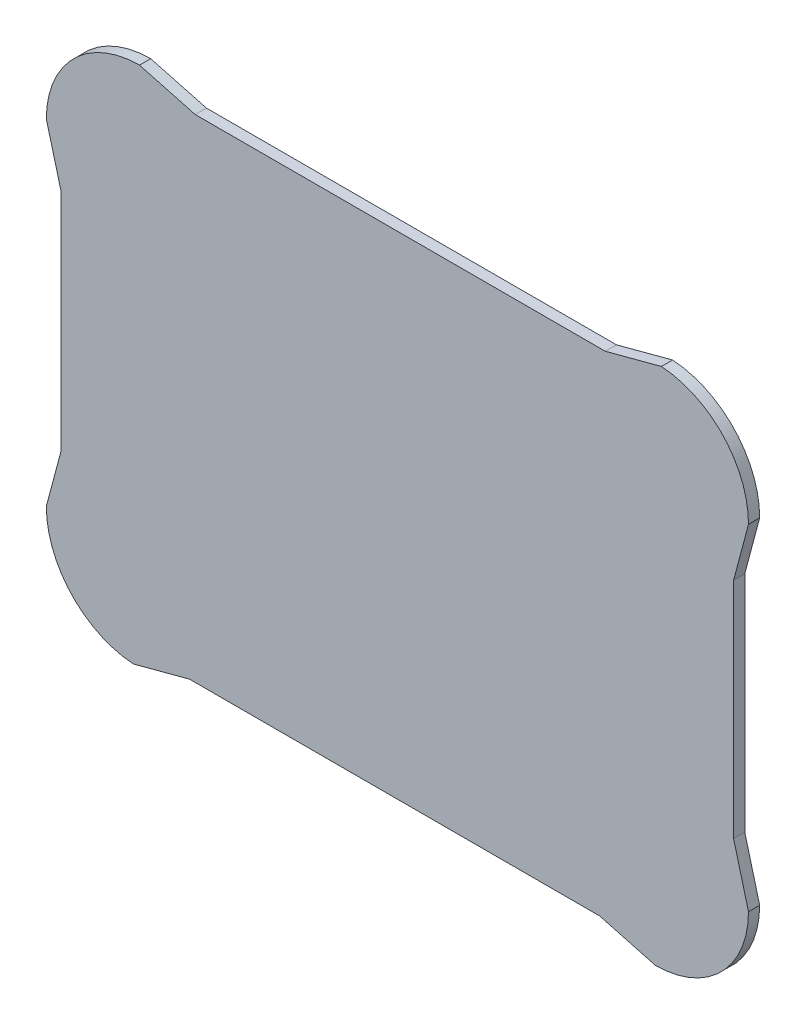
from build123d import *

# Parameters (mm, degrees)
BOSS_EXTRU_1_DEPTH = 6


with BuildPart() as part:
    # Esquisse1 → Boss.-Extru.1 (new body)
    with BuildSketch(Plane.XY):
        with BuildLine():
            Line((-373.69467463, 106.042558597), (-365.69467463, 76.042558597))
            Line((-365.69467463, 76.042558597), (-365.69467463, -43.957441403))
            Line((-365.69467463, -43.957441403), (-373.69467463, -73.957441403))
            ThreePointArc((-373.69467463, -73.957441403), (-360.192601556, -108.141248671), (-326.969404712, -123.859322601))
            Line((-326.969404712, -123.859322601), (-296.875879039, -115.85986931))
            Line((-296.875879039, -115.85986931), (-76.875879039, -115.85986931))
            Line((-76.875879039, -115.85986931), (-46.969404712, -123.859322601))
            ThreePointArc((-46.969404712, -123.859322601), (-11.649350298, -109.24901926), (3.029605382, -73.957441403))
            Line((3.029605382, -73.957441403), (-4.970394618, -43.957441403))
            Line((-4.970394618, -43.957441403), (-4.970394618, 76.042558597))
            Line((-4.970394618, 76.042558597), (3.029605382, 106.042558597))
            ThreePointArc((3.029605382, 106.042558597), (-10.442134726, 140.284021287), (-43.697023707, 156.03451041))
            Line((-43.697023707, 156.03451041), (-73.79054938, 148.035057119))
            Line((-73.79054938, 148.035057119), (-293.79054938, 148.035057119))
            Line((-293.79054938, 148.035057119), (-323.697023707, 156.03451041))
            ThreePointArc((-323.697023707, 156.03451041), (-359.04799913, 141.391864616), (-373.69467463, 106.042558597))
        make_face()
    extrude(amount=BOSS_EXTRU_1_DEPTH)


solid = part.part
